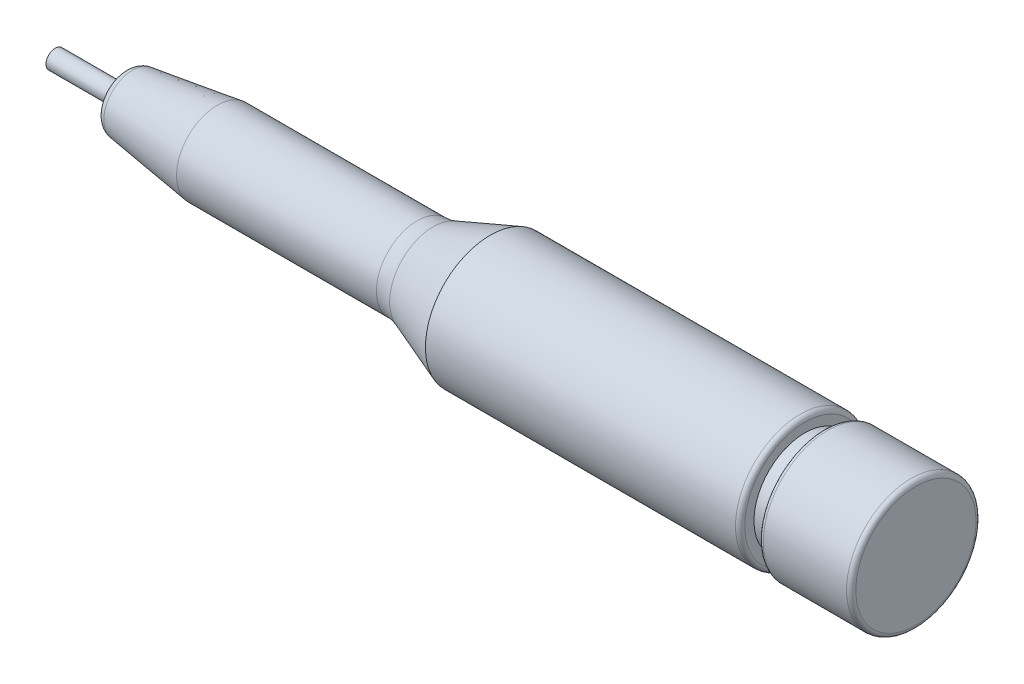
from build123d import *

# Parameters (mm, degrees)
FILETE1_R = 5
FILETE3_R = 1
FILETE4_R = 0.5


with BuildPart() as part:
    # Esboço1 → Revolução1 (revolve)
    with BuildSketch(Plane.XY, mode=Mode.PRIVATE) as revolu_o1_sk:
        Polygon((0, 0), (0, 1), (7.5, 1), (7.5, 3), (17.5, 4.4), (40, 4.4), (47, 7), (81, 7), (81, 5.5), (83, 5.5), (83, 7), (93, 7), (93, 0), align=None)
    revolve(revolu_o1_sk.sketch.rotate(Axis((93, 0, 0), (-1, 0, 0)), 90), axis=Axis((93, 0, 0), (-1, 0, 0)))

    # Filete1
    filete1_edges = [part.edges().sort_by_distance(p)[0] for p in [
        (40, 0, 4.4),
    ]]
    fillet(filete1_edges, radius=FILETE1_R)

    # Filete3
    filete3_edges = [part.edges().sort_by_distance(p)[0] for p in [
        (7.5, 0, 3),
    ]]
    fillet(filete3_edges, radius=FILETE3_R)

    # Filete4
    filete4_edges = [part.edges().sort_by_distance(p)[0] for p in [
        (81, 0, 7),
        (93, 0, 7),
        (83, 0, 7),
    ]]
    fillet(filete4_edges, radius=FILETE4_R)


solid = part.part
